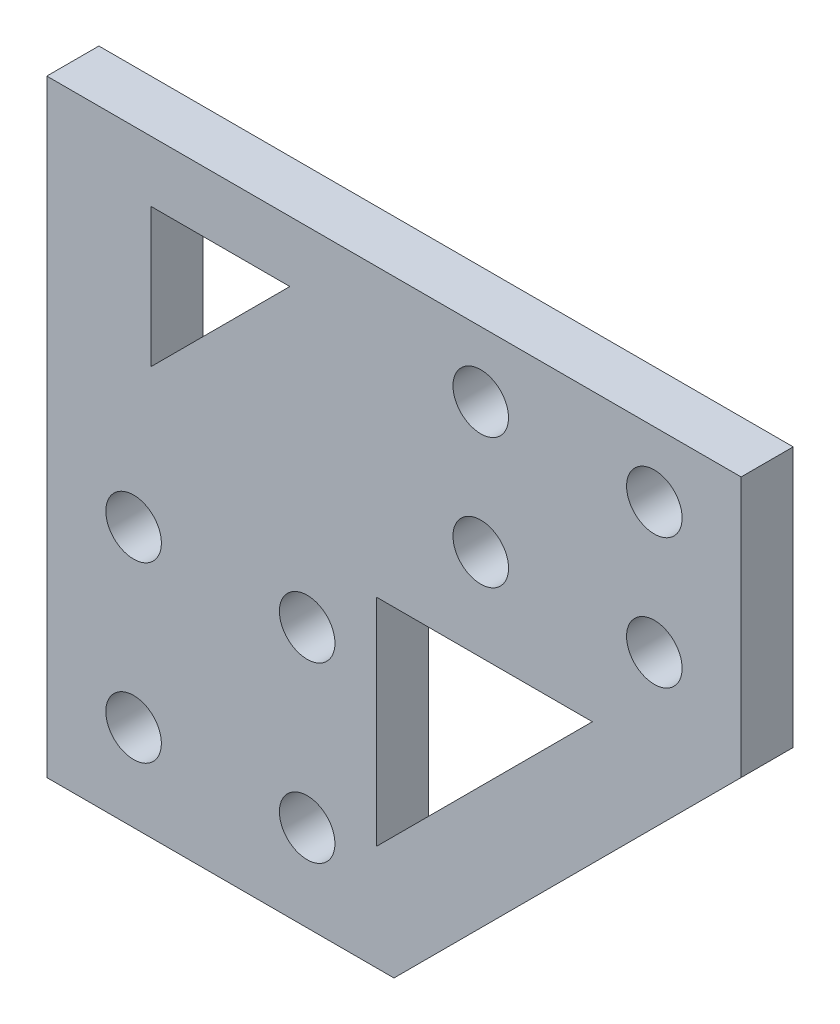
from build123d import *

# Parameters (mm, degrees)
SKETCH_1_R      = 1.6
EXTRUDE_1_DEPTH = 3


with BuildPart() as part:
    # 草图1 → 凸台-拉伸1 (new body)
    with BuildSketch(Plane.XY):
        Polygon((0, 0), (40, 0), (40, -15), (20, -35), (0, -35), align=None)
        with Locations((5, -30)):
            Circle(SKETCH_1_R, mode=Mode.SUBTRACT)
        with Locations(Location((15, -30, 0), (0, 0, 180))):
            Circle(SKETCH_1_R, mode=Mode.SUBTRACT)
        with Locations((15, -20)):
            Circle(SKETCH_1_R, mode=Mode.SUBTRACT)
        with Locations(Location((5, -20, 0), (0, 0, 180))):
            Circle(SKETCH_1_R, mode=Mode.SUBTRACT)
        with Locations((35, -3.75)):
            Circle(SKETCH_1_R, mode=Mode.SUBTRACT)
        with Locations(Location((35, -11.25, 0), (0, 0, 180))):
            Circle(SKETCH_1_R, mode=Mode.SUBTRACT)
        with Locations((25, -11.25)):
            Circle(SKETCH_1_R, mode=Mode.SUBTRACT)
        with Locations(Location((25, -3.75, 0), (0, 0, 180))):
            Circle(SKETCH_1_R, mode=Mode.SUBTRACT)
        Polygon((19, -16.5), (19, -28.928932188), (31.428932188, -16.5), align=None, mode=Mode.SUBTRACT)
        Polygon((6, -3.5), (14, -3.5), (6, -11.5), align=None, mode=Mode.SUBTRACT)
    extrude(amount=EXTRUDE_1_DEPTH)


solid = part.part
